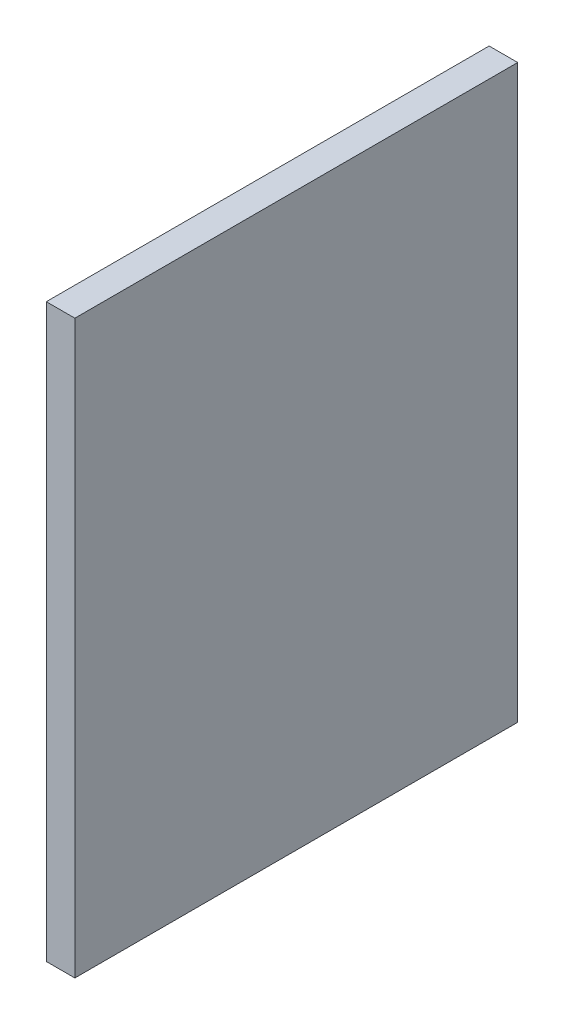
from build123d import *

# Parameters (mm, degrees)
SKCAJASUJETADORAESTE_W   = 20
SKCAJASUJETADORAESTE_H   = 310
CAJASUJETADORAESTE_DEPTH = 400


with BuildPart() as part:
    # SkCajaSujetadoraEste → CajaSujetadoraEste (new body)
    with BuildSketch(Plane(origin=(0, 630, 0), x_dir=(1, 0, 0), z_dir=(0, 1, 0))):
        with Locations((145, 0)):
            Rectangle(SKCAJASUJETADORAESTE_W, SKCAJASUJETADORAESTE_H)
    extrude(amount=CAJASUJETADORAESTE_DEPTH)


solid = part.part
